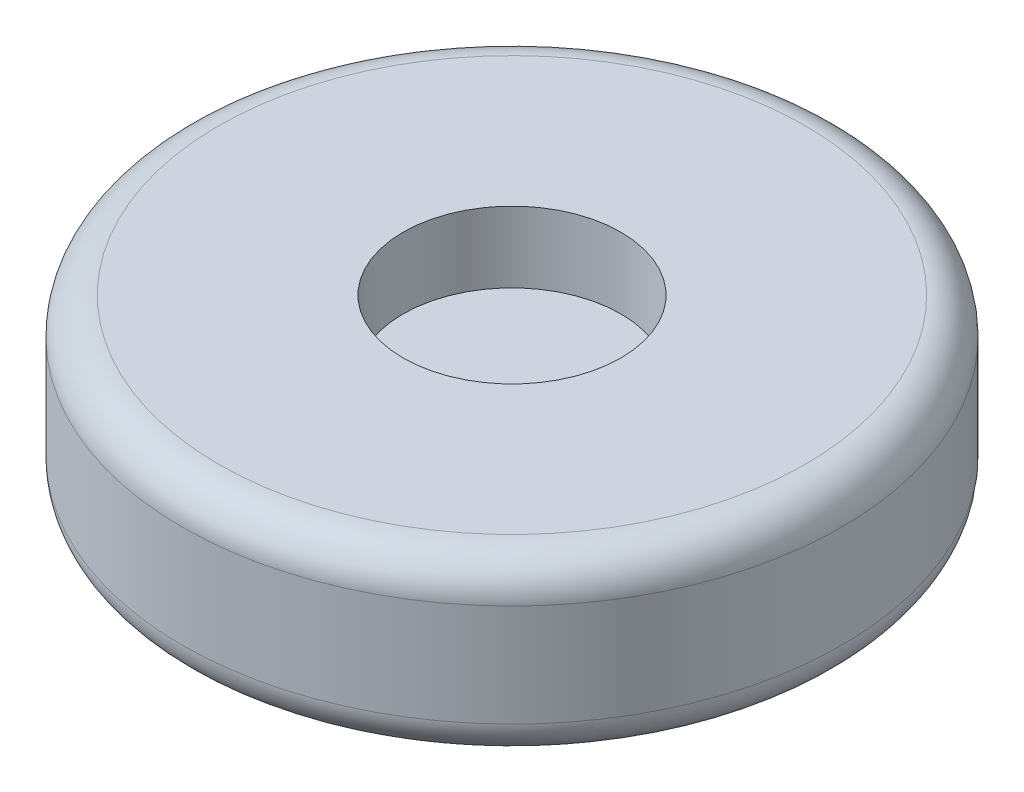
from build123d import *


with BuildPart() as part:
    # Sketch1 → Revolve1 (revolve)
    with BuildSketch(Plane(origin=(0, 0, 0), x_dir=(0, 0, -1), z_dir=(1, 0, 0))):
        with BuildLine():
            Line((0, -12.118048154), (0, -15.348048154))
            Line((0, -15.348048154), (-16.15, -15.348048154))
            ThreePointArc((-16.15, -15.348048154), (-17.564213562, -14.762261716), (-18.15, -13.348048154))
            Line((-18.15, -13.348048154), (-18.15, -7.718048154))
            ThreePointArc((-18.15, -7.718048154), (-17.564213562, -6.303834591), (-16.15, -5.718048154))
            Line((-16.15, -5.718048154), (-6, -5.718048154))
            Line((-6, -5.718048154), (-6, -9.618048154))
            Line((-6, -9.618048154), (-14.25, -9.618048154))
            Line((-14.25, -9.618048154), (-14.25, -12.118048154))
            Line((-14.25, -12.118048154), (0, -12.118048154))
        make_face()
    revolve(axis=Axis((0, 41.234250563, 0), (0, -1, 0)))


solid = part.part
